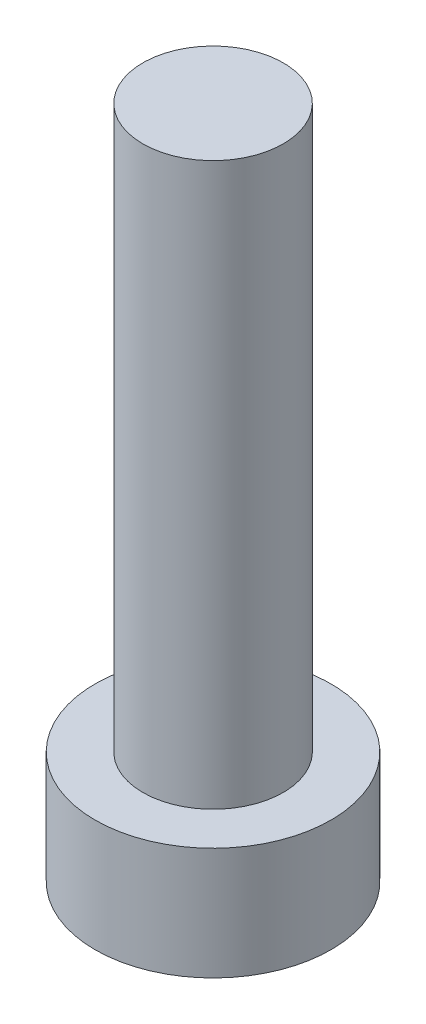
from build123d import *

# Parameters (mm, degrees)
SKETCH_1_R          = 2.1
EXTRUDE_1_DEPTH     = 2
SKETCH_2_R          = 1.25
EXTRUDE_2_DEPTH     = 10
CUT_EXTRUDE_1_DEPTH = 1.5


with BuildPart() as part:
    # 草图1 → 凸台-拉伸1 (new body)
    with BuildSketch(Plane(origin=(0, 0, 0), x_dir=(1, 0, 0), z_dir=(0, 1, 0))):
        with Locations(Location((0, 0, 0), (0, 0, 270))):
            Circle(SKETCH_1_R)
    extrude(amount=EXTRUDE_1_DEPTH)

    # 草图2 → 凸台-拉伸2 (add)
    with BuildSketch(Plane(origin=(0, 2, 0), x_dir=(1, 0, 0), z_dir=(0, 1, 0))):
        with Locations(Location((0, 0, 0), (0, 0, 270))):
            Circle(SKETCH_2_R)
    extrude(amount=EXTRUDE_2_DEPTH)

    # 草图3 → 切除-拉伸1 (cut)
    with BuildSketch(Plane.XZ):
        Polygon((1, 0), (0.5, 0.866025404), (-0.5, 0.866025404), (-1, 0), (-0.5, -0.866025404), (0.5, -0.866025404), align=None)
    extrude(amount=-CUT_EXTRUDE_1_DEPTH, mode=Mode.SUBTRACT)


solid = part.part
